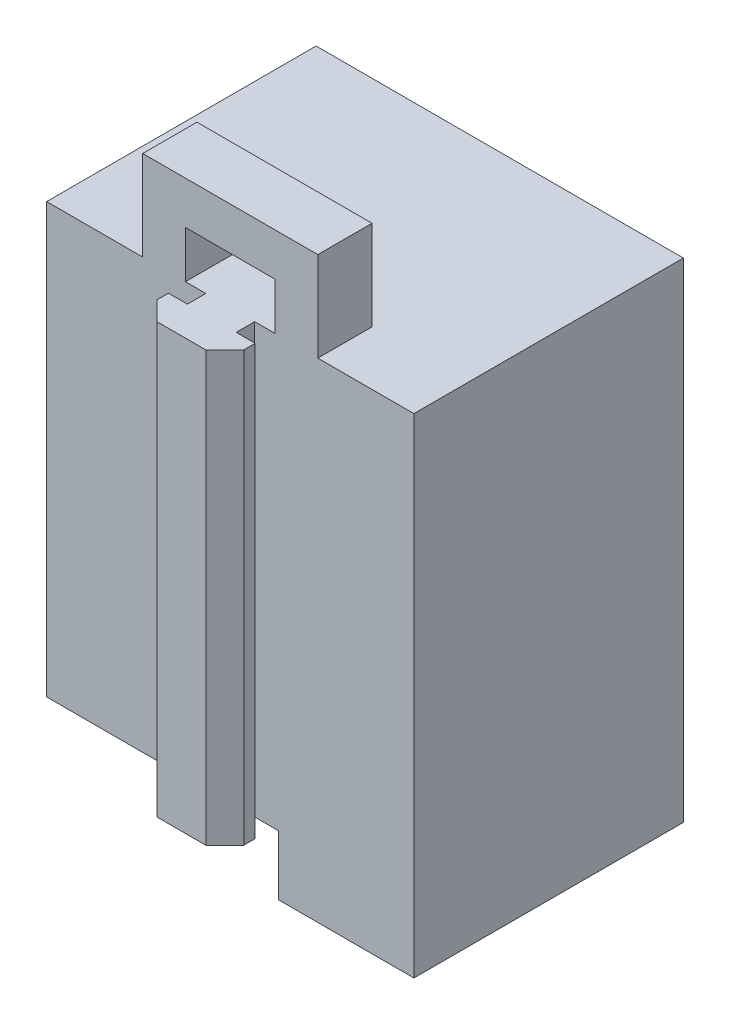
from build123d import *

# Parameters (mm, degrees)
BOSS_EXTRUDE1_DEPTH = 25.2
BOSS_EXTRUDE2_DEPTH = 6.35
BOSS_EXTRUDE3_START = 2
BOSS_EXTRUDE3_DEPTH = 5
SKETCH4_W           = 6
SKETCH4_H           = 2
BOSS_EXTRUDE4_DEPTH = 6.35
BOSS_EXTRUDE5_DEPTH = 50.228


with BuildPart() as part:
    # Sketch1 → Boss-Extrude1 (new body)
    with BuildSketch(Plane.XY):
        Polygon((-16.5, -29.728), (-16.5, 15.5), (16.5, 15.5), (16.5, -28.399762486), (16.5, -31.728), (11.67, -31.728), (11.67, -36.728), (21.5, -36.728), (21.5, 20.5), (-21.5, 20.5), (-21.5, -29.728), align=None)
    extrude(amount=-BOSS_EXTRUDE1_DEPTH)

    # Sketch2 → Boss-Extrude2 (add)
    with BuildSketch(Plane.XY):
        Polygon((-21.5, 20.5), (21.5, 20.5), (21.5, -29.728), (21.5, -36.728), (11.67, -36.728), (11.67, -29.728), (-21.5, -29.728), align=None)
    extrude(amount=BOSS_EXTRUDE2_DEPTH)

    # Sketch3 → Boss-Extrude3 (add)
    with BuildSketch(Plane.XZ.offset(29.728).offset(BOSS_EXTRUDE3_START)):
        Polygon((11.67, 6.35), (5.67, 6.35), (5.67, 0), (11.67, -6), align=None)
    extrude(amount=BOSS_EXTRUDE3_DEPTH)

    # Sketch4 → Boss-Extrude4 (add)
    with BuildSketch(Plane.XY.offset(6.35)):
        Polygon((-10.25, 20.5), (-5.25, 20.5), (-5.25, 26), (5.25, 26), (5.25, 20.5), (10.25, 20.5), (10.25, 31), (-10.25, 31), align=None)
        with Locations((8.67, -30.728)):
            Rectangle(SKETCH4_W, SKETCH4_H)
    extrude(amount=-BOSS_EXTRUDE4_DEPTH)

    # Sketch5 → Boss-Extrude5 (add)
    with BuildSketch(Plane(origin=(0, 20.5, 0), x_dir=(1, 0, 0), z_dir=(0, 1, 0))):
        Polygon((-2.86, -6.35), (-2.86, -8.51), (-5.08, -8.51), (-5.08, -9.85), (-2.86, -12.07), (2.86, -12.07), (5.08, -9.85), (5.08, -8.51), (2.86, -8.51), (2.86, -6.35), align=None)
    extrude(amount=-BOSS_EXTRUDE5_DEPTH)


solid = part.part
